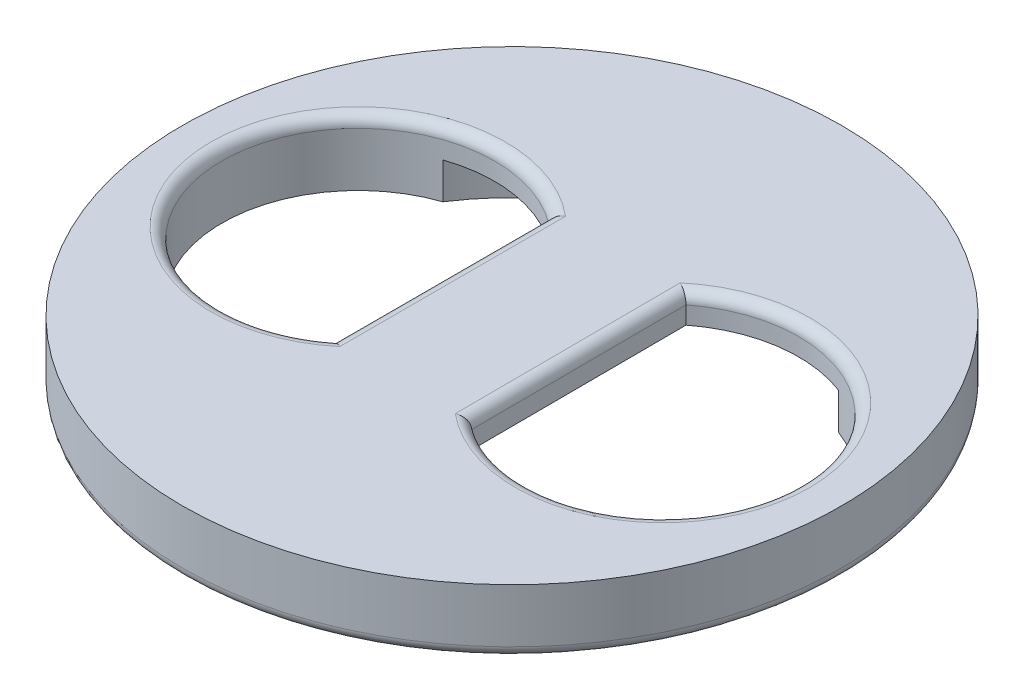
from build123d import *

# Parameters (mm, degrees)
SKETCH1_R           = 15
BOSS_EXTRUDE1_DEPTH = 1.3
BOSS_EXTRUDE2_START = -1.65
SKETCH1_3_R         = 15
SKETCH1_3_R_2       = 10.75
BOSS_EXTRUDE2_DEPTH = 1.65
CUT_EXTRUDE1_START  = -10
SKETCH1_5_R         = 10.75
SKETCH1_5_R_2       = 6.2
CUT_EXTRUDE1_DEPTH  = 10
FILLET5_R           = 0.5
FILLET6_R           = 0.5


with BuildPart() as part:
    # Sketch1 → Boss-Extrude1 (new body)
    with BuildSketch(Plane(origin=(0, 0, 0), x_dir=(1, 0, 0), z_dir=(0, 1, 0))):
        with Locations(Location((0, 0, 0), (0, 0, 270))):
            Circle(SKETCH1_R)
        with BuildLine():
            ThreePointArc((-13.2, 0), (-9.727636339, 5.567764363), (-3.2, 4.898979486))
            Line((-3.2, 4.898979486), (-3.2, -4.898979486))
            ThreePointArc((-3.2, -4.898979486), (-9.727636339, -5.567764363), (-13.2, 0))
        make_face(mode=Mode.SUBTRACT)
        with BuildLine():
            Line((3.071845277, -4.91349301), (3.034307887, 4.884394056))
            ThreePointArc((3.034307887, 4.884394056), (13.053003194, 0.023761962), (3.071845277, -4.91349301))
        make_face(mode=Mode.SUBTRACT)
    extrude(amount=BOSS_EXTRUDE1_DEPTH)

    # Sketch1<3> → Boss-Extrude2 (add)
    with BuildSketch(Plane(origin=(0, 0, 0), x_dir=(1, 0, 0), z_dir=(0, 1, 0)).offset(BOSS_EXTRUDE2_START)):
        with Locations(Location((0, 0, 0), (0, 0, 270))):
            Circle(SKETCH1_3_R)
        with Locations(Location((0, 0, 0), (0, 0, 270))):
            Circle(SKETCH1_3_R_2, mode=Mode.SUBTRACT)
    extrude(amount=BOSS_EXTRUDE2_DEPTH)

    # Sketch1<5> → Cut-Extrude1 (cut)
    with BuildSketch(Plane(origin=(0, 0, 0), x_dir=(1, 0, 0), z_dir=(0, 1, 0)).offset(CUT_EXTRUDE1_START)):
        with BuildLine():
            ThreePointArc((-9.00875, -5.865571024), (-10.305497623, -3.059284026), (-10.75, 0))
            Line((-10.75, 0), (-13.2, 0))
            ThreePointArc((-13.2, 0), (-12.044514347, -3.60456308), (-9.00875, -5.865571024))
        make_face()
        with BuildLine():
            Line((-13.2, 0), (-10.75, 0))
            ThreePointArc((-10.75, 0), (-10.305497623, 3.059284026), (-9.00875, 5.865571024))
            ThreePointArc((-9.00875, 5.865571024), (-12.044514347, 3.60456308), (-13.2, 0))
        make_face()
        Circle(SKETCH1_5_R)
        with Locations((6.853048695, 8.87e-06)):
            Circle(SKETCH1_5_R_2)
    extrude(amount=CUT_EXTRUDE1_DEPTH, mode=Mode.SUBTRACT)

    # Fillet5
    fillet5_edges = [part.edges().sort_by_distance(p)[0] for p in [
        (-3.2, 1.3, 0),
        (13.053003194, 1.3, -0.023761962),
        (3.053076582, 1.3, 0.014549477),
        (-13.2, 1.3, 0),
    ]]
    fillet(fillet5_edges, radius=FILLET5_R)

    # Fillet6
    fillet6_edges = [part.edges().sort_by_distance(p)[0] for p in [
        (0, -1.65, -15),
        (0.041164562, -1.65, 10.749921185),
    ]]
    fillet(fillet6_edges, radius=FILLET6_R)


solid = part.part
